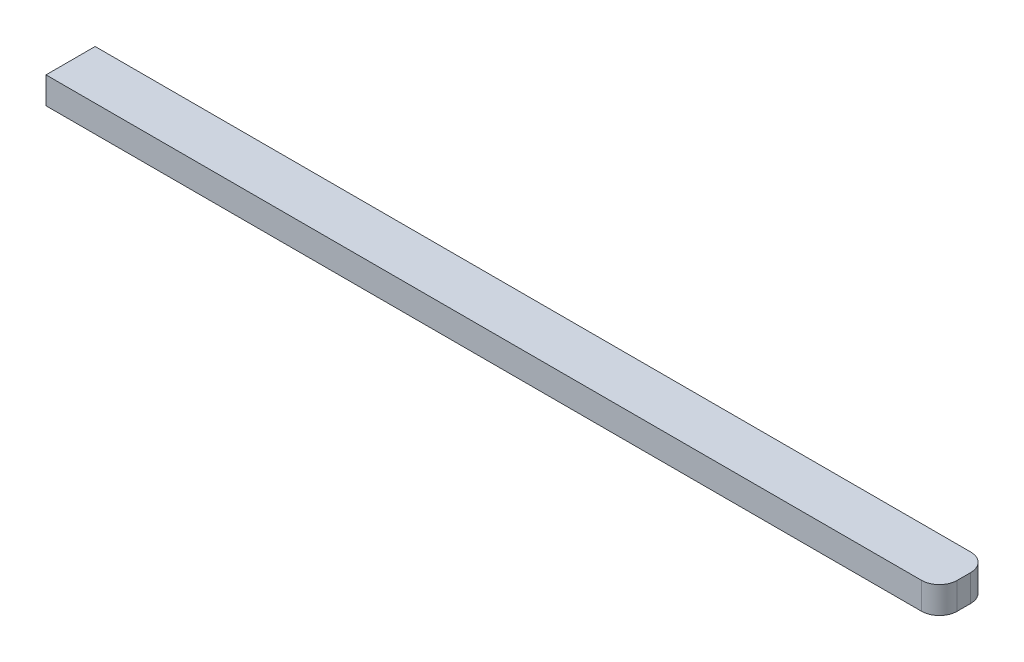
from build123d import *

# Parameters (mm, degrees)
SKETCH_1_W      = 100
SKETCH_1_H      = 5.5
EXTRUDE_1_DEPTH = 3
FILLET_1_R      = 2


with BuildPart() as part:
    # Эскиз1 → Бобышка-Вытянуть1 (new body)
    with BuildSketch(Plane(origin=(0, 0, 0), x_dir=(1, 0, 0), z_dir=(0, 1, 0))):
        with Locations((-6.596735768, -0.868717121)):
            Rectangle(SKETCH_1_W, SKETCH_1_H)
    extrude(amount=EXTRUDE_1_DEPTH)

    # Скругление1
    fillet_1_edges = [part.edges().sort_by_distance(p)[0] for p in [
        (43.403264232, 1.5, -1.881282879),
        (43.403264232, 1.5, 3.618717121),
    ]]
    fillet(fillet_1_edges, radius=FILLET_1_R)


solid = part.part
